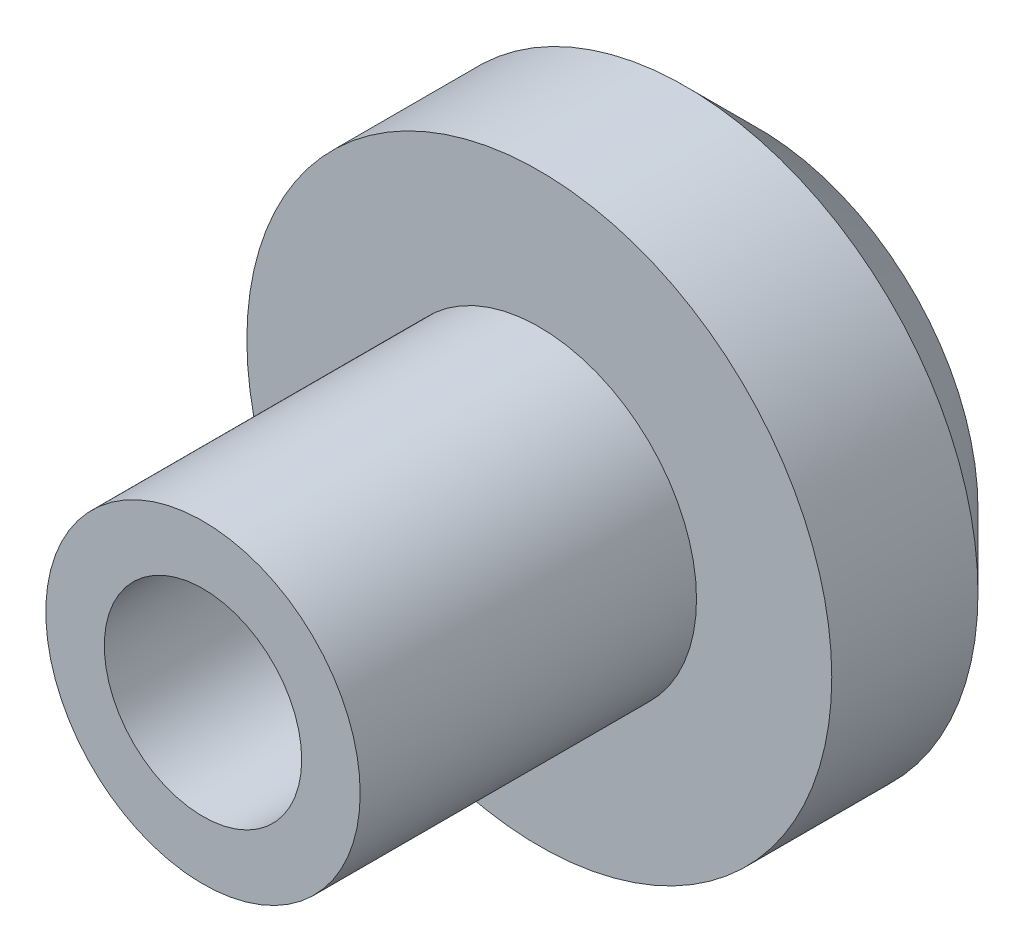
from build123d import *

# Parameters (mm, degrees)
SKETCH1_R           = 4
BOSS_EXTRUDE1_DEPTH = 3
SKETCH2_R           = 2.15
BOSS_EXTRUDE2_DEPTH = 4.6
SKETCH3_R           = 1.35
CUT_EXTRUDE1_DEPTH  = 10.474175426
CHAMFER1_SIZE       = 1


with BuildPart() as part:
    # Sketch1 → Boss-Extrude1 (new body)
    with BuildSketch(Plane.XY):
        Circle(SKETCH1_R)
    extrude(amount=BOSS_EXTRUDE1_DEPTH)

    # Sketch2 → Boss-Extrude2 (add)
    with BuildSketch(Plane.XY.offset(3)):
        Circle(SKETCH2_R)
    extrude(amount=BOSS_EXTRUDE2_DEPTH)

    # Sketch3 → Cut-Extrude1 (cut, through all)
    with BuildSketch(Plane.XY.offset(7.6)):
        Circle(SKETCH3_R)
    extrude(amount=-CUT_EXTRUDE1_DEPTH, mode=Mode.SUBTRACT)

    # Chamfer1
    chamfer1_edges = [part.edges().sort_by_distance(p)[0] for p in [
        (-4, 0, 0),
    ]]
    chamfer(chamfer1_edges, length=CHAMFER1_SIZE)


solid = part.part
